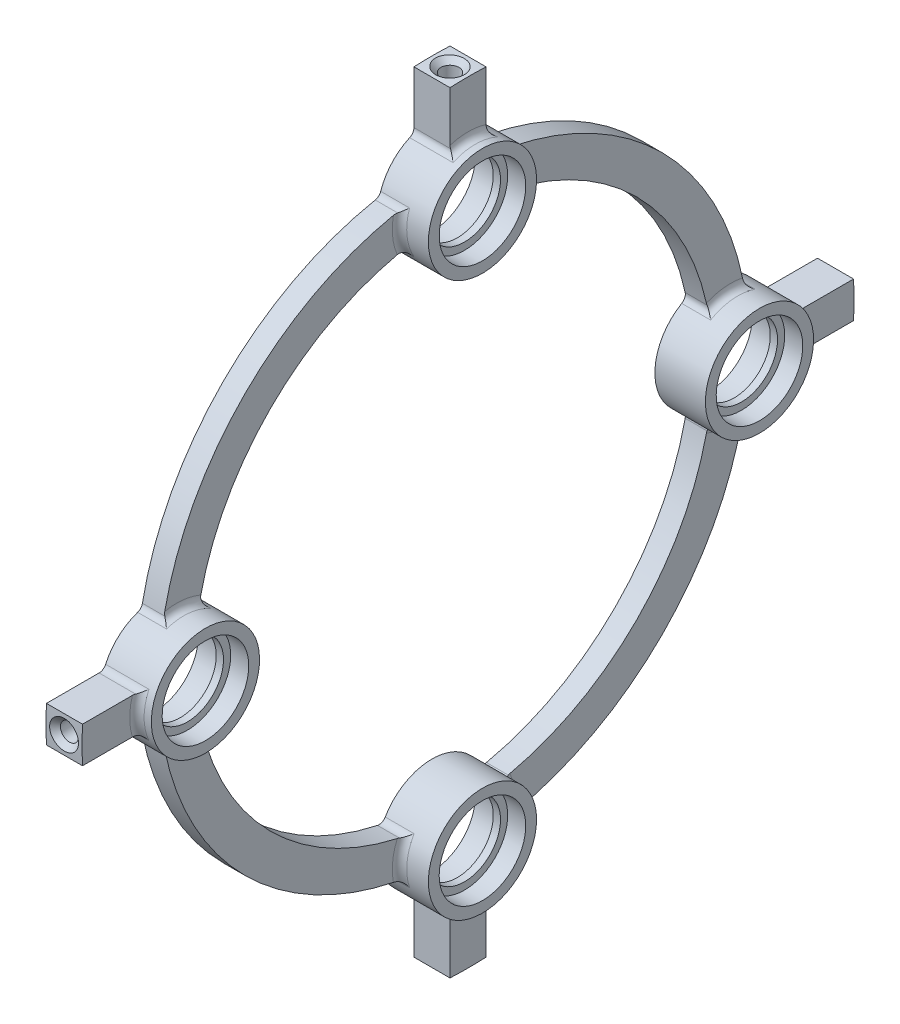
from build123d import *

# Parameters (mm, degrees)
SKETCH_1_R                       = 40.9
SKETCH_1_R_2                     = 35.9
EXTRUDE_1_DEPTH                  = 3
SKETCH_2_R                       = 7.5
EXTRUDE_2_DEPTH                  = 7
SKETCH_4_R                       = 5
CUT_EXTRUDE_1_DEPTH              = 62.875843429
SKETCH_5_R                       = 6
CUT_EXTRUDE_2_DEPTH              = 3.5
CUT_EXTRUDE_START                = -2.5
SKETCH_6_R                       = 6
CUT_EXTRUDE_3_DEPTH              = 2.5
EXTRUDE_3_DEPTH                  = 5
FILLET_1_R                       = 1
PATTERN_CIRCULAR_1_COUNT         = 4
FILLET_1_OF_PATTERN_CIRCULAR_1_R = 1


with BuildPart() as part:
    # Эскиз1 → Бобышка-Вытянуть1 (new body)
    with BuildSketch(Plane(origin=(0, 0, 0), x_dir=(0, 0, -1), z_dir=(1, 0, 0))):
        Circle(SKETCH_1_R)
        Circle(SKETCH_1_R_2, mode=Mode.SUBTRACT)
    extrude(amount=EXTRUDE_1_DEPTH)

    # Эскиз2 → Бобышка-Вытянуть2 (add)
    with BuildSketch(Plane.ZY):
        with Locations((0, 38.4)):
            Circle(SKETCH_2_R)
    extrude_2 = extrude(amount=-EXTRUDE_2_DEPTH)

    # Эскиз4 → Вырез-Вытянуть1 (cut, through all)
    with BuildSketch(Plane.ZY):
        with Locations((0, 38.4)):
            Circle(SKETCH_4_R)
    cut_extrude_1 = extrude(amount=-CUT_EXTRUDE_1_DEPTH, mode=Mode.SUBTRACT)

    # Эскиз5 → Вырез-Вытянуть2 (cut)
    with BuildSketch(Plane.ZY):
        with Locations((0, 38.4)):
            Circle(SKETCH_5_R)
    cut_extrude_2 = extrude(amount=-CUT_EXTRUDE_2_DEPTH, mode=Mode.SUBTRACT)

    # Эскиз6 → Вырез-Вытянуть3 (cut)
    with BuildSketch(Plane(origin=(7, 0, 0), x_dir=(0, 0, -1), z_dir=(1, 0, 0)).offset(CUT_EXTRUDE_START)):
        with Locations(Location((0, 38.4, 0), (0, 0, 180))):
            Circle(SKETCH_6_R)
    cut_extrude_3 = extrude(amount=CUT_EXTRUDE_3_DEPTH, mode=Mode.SUBTRACT)

    # Эскиз7 → Бобышка-Вытянуть3 (add)
    with BuildSketch(Plane.ZY):
        with BuildLine():
            Line((-2.5, 53.441556864), (-2.5, 45.471067812))
            ThreePointArc((-2.5, 45.471067812), (0, 45.9), (2.5, 45.471067812))
            Line((2.5, 45.471067812), (2.5, 53.441556864))
            ThreePointArc((2.5, 53.441556864), (0, 53.5), (-2.5, 53.441556864))
        make_face()
    extrude_3 = extrude(amount=-EXTRUDE_3_DEPTH)

    # Скругление1
    fillet_1_edges = [part.edges().sort_by_distance(p)[0] for p in [
        (1.5, 35.248958333, 6.805948605),
        (1.5, 35.248958333, -6.805948605),
        (3, 36.786713686, 7.324432215),
        (3, 37.709096353, -7.468109008),
        (1.5, 40.248958333, -7.268517943),
        (1.5, 40.248958333, 7.268517943),
        (5, 45.9, 0),
        (2.5, 45.471067812, 2.5),
        (2.5, 45.471067812, -2.5),
    ]]
    fillet(fillet_1_edges, radius=FILLET_1_R)

    # Эскиз8 → Отверстие обработанное метчиком M31 (revolve, cut)
    with BuildSketch(Plane(origin=(2.5, 53.5, 0), x_dir=(0, 0, 1), z_dir=(1, 0, 0))):
        Polygon((0, 0), (0, 7.751075774), (1.25, 7), (1.25, 0.75), (2, 0), align=None)
    hole_wizard_m31 = revolve(axis=Axis((2.5, 59.85, 0), (0, -1, 0)), mode=Mode.SUBTRACT)

    # Круговой массив1: Бобышка-Вытянуть2, Вырез-Вытянуть1, Вырез-Вытянуть2, Вырез-Вытянуть3, Бобышка-Вытянуть3, Отверстие обработанное метчиком M31 ×4 about axis
    pattern_circular_1_axis = Axis((0, 0, 0), (1, 0, 0))
    add([extrude_2.rotate(pattern_circular_1_axis, i * 360 / PATTERN_CIRCULAR_1_COUNT) for i in range(1, PATTERN_CIRCULAR_1_COUNT)])
    add([cut_extrude_1.rotate(pattern_circular_1_axis, i * 360 / PATTERN_CIRCULAR_1_COUNT) for i in range(1, PATTERN_CIRCULAR_1_COUNT)], mode=Mode.SUBTRACT)
    add([cut_extrude_2.rotate(pattern_circular_1_axis, i * 360 / PATTERN_CIRCULAR_1_COUNT) for i in range(1, PATTERN_CIRCULAR_1_COUNT)], mode=Mode.SUBTRACT)
    add([cut_extrude_3.rotate(pattern_circular_1_axis, i * 360 / PATTERN_CIRCULAR_1_COUNT) for i in range(1, PATTERN_CIRCULAR_1_COUNT)], mode=Mode.SUBTRACT)
    add([extrude_3.rotate(pattern_circular_1_axis, i * 360 / PATTERN_CIRCULAR_1_COUNT) for i in range(1, PATTERN_CIRCULAR_1_COUNT)])
    add([hole_wizard_m31.rotate(pattern_circular_1_axis, i * 360 / PATTERN_CIRCULAR_1_COUNT) for i in range(1, PATTERN_CIRCULAR_1_COUNT)], mode=Mode.SUBTRACT)

    # Скругление1 of Круговой массив1
    fillet_1_of_pattern_circular_1_edges = [part.edges().sort_by_distance(p)[0] for p in [
        (1.5, -6.805948605, 35.248958333),
        (1.5, 6.805948605, 35.248958333),
        (3, -7.324432215, 36.786713686),
        (3, 7.468109008, 37.709096353),
        (1.5, 7.268517943, 40.248958333),
        (1.5, -7.268517943, 40.248958333),
        (5, 0, 45.9),
        (2.5, -2.5, 45.471067812),
        (2.5, 2.5, 45.471067812),
        (1.5, -35.248958333, -6.805948605),
        (1.5, -35.248958333, 6.805948605),
        (3, -36.786713686, -7.324432215),
        (3, -37.709096353, 7.468109008),
        (1.5, -40.248958333, 7.268517943),
        (1.5, -40.248958333, -7.268517943),
        (5, -45.9, 0),
        (2.5, -45.471067812, -2.5),
        (2.5, -45.471067812, 2.5),
        (1.5, 6.805948605, -35.248958333),
        (1.5, -6.805948605, -35.248958333),
        (3, 7.324432215, -36.786713686),
        (3, -7.468109008, -37.709096353),
        (1.5, -7.268517943, -40.248958333),
        (1.5, 7.268517943, -40.248958333),
        (5, 0, -45.9),
        (2.5, 2.5, -45.471067812),
        (2.5, -2.5, -45.471067812),
    ]]
    fillet(fillet_1_of_pattern_circular_1_edges, radius=FILLET_1_OF_PATTERN_CIRCULAR_1_R)


solid = part.part
